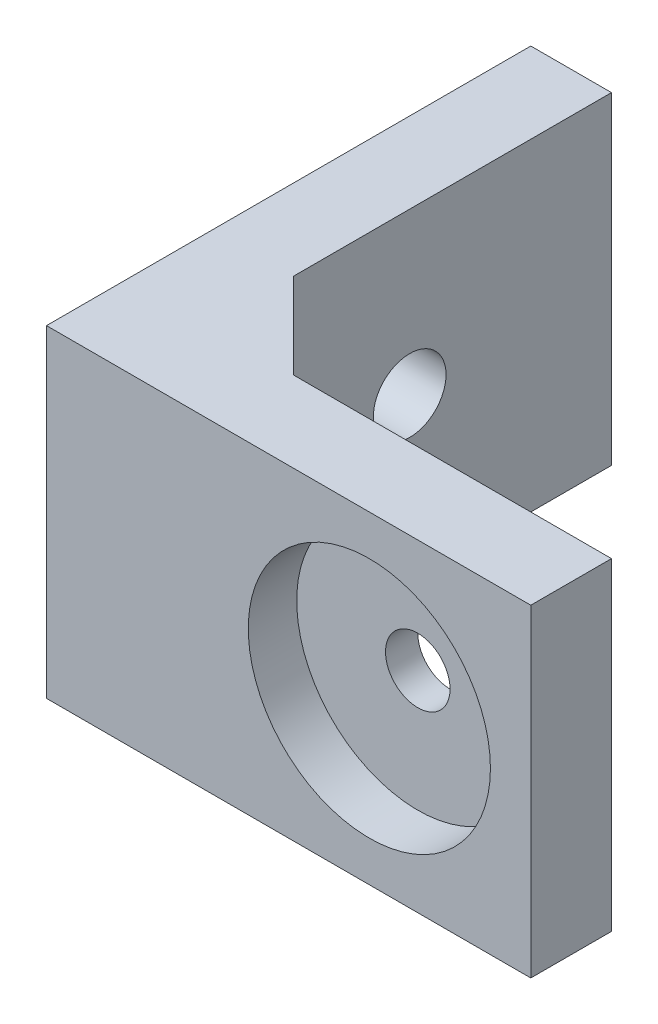
from build123d import *

# Parameters (mm, degrees)
ESTRUSIONE_ESTRUSIONE2_DEPTH = 20
FORO_PER_VITE_M4_2_D         = 4.5
FORO_PER_VITE_M4_2_DEPTH     = 15
FORO_PER_VITE_M4_2_TIP       = 1.351936393
SCHIZZO6_R                   = 7.5
TAGLIO_ESTRUSIONE1_DEPTH     = 3
FORO_PER_VITE_M4_1_D         = 4
FORO_PER_VITE_M4_1_DEPTH     = 9
FORO_PER_VITE_M4_1_TIP       = 1.201721238


with BuildPart() as part:
    # Schizzo2 → Estrusione-Estrusione2 (new body)
    with BuildSketch(Plane(origin=(0, 0, 0), x_dir=(1, 0, 0), z_dir=(0, 1, 0))):
        Polygon((5, 30), (5, 10.303300859), (10.303300859, 5), (30, 5), (30, 0), (0, 0), (0, 30), align=None)
    extrude(amount=ESTRUSIONE_ESTRUSIONE2_DEPTH)

    # Foro per Vite M4-2
    with Locations(Plane(origin=(5, 0, 0), x_dir=(0, 0, -1), z_dir=(1, 0, 0))):
        with Locations((17.5, 10)):
            Hole(FORO_PER_VITE_M4_2_D / 2, depth=FORO_PER_VITE_M4_2_DEPTH)
            with Locations((0, 0, -(FORO_PER_VITE_M4_2_DEPTH + FORO_PER_VITE_M4_2_TIP / 2))):  # 118° drill point
                Cone(0, FORO_PER_VITE_M4_2_D / 2, FORO_PER_VITE_M4_2_TIP, mode=Mode.SUBTRACT)

    # Schizzo6 → Taglio-Estrusione1 (cut)
    with BuildSketch(Plane.XY):
        with Locations((20, 10)):
            Circle(SCHIZZO6_R)
    extrude(amount=-TAGLIO_ESTRUSIONE1_DEPTH, mode=Mode.SUBTRACT)

    # Foro per Vite M4-1
    with Locations(Plane(origin=(20, 10, 0), x_dir=(1, 0, 0), z_dir=(0, 0, 1))):
        with Locations((0, 0)):
            Hole(FORO_PER_VITE_M4_1_D / 2, depth=FORO_PER_VITE_M4_1_DEPTH)
            with Locations((0, 0, -(FORO_PER_VITE_M4_1_DEPTH + FORO_PER_VITE_M4_1_TIP / 2))):  # 118° drill point
                Cone(0, FORO_PER_VITE_M4_1_D / 2, FORO_PER_VITE_M4_1_TIP, mode=Mode.SUBTRACT)


solid = part.part
